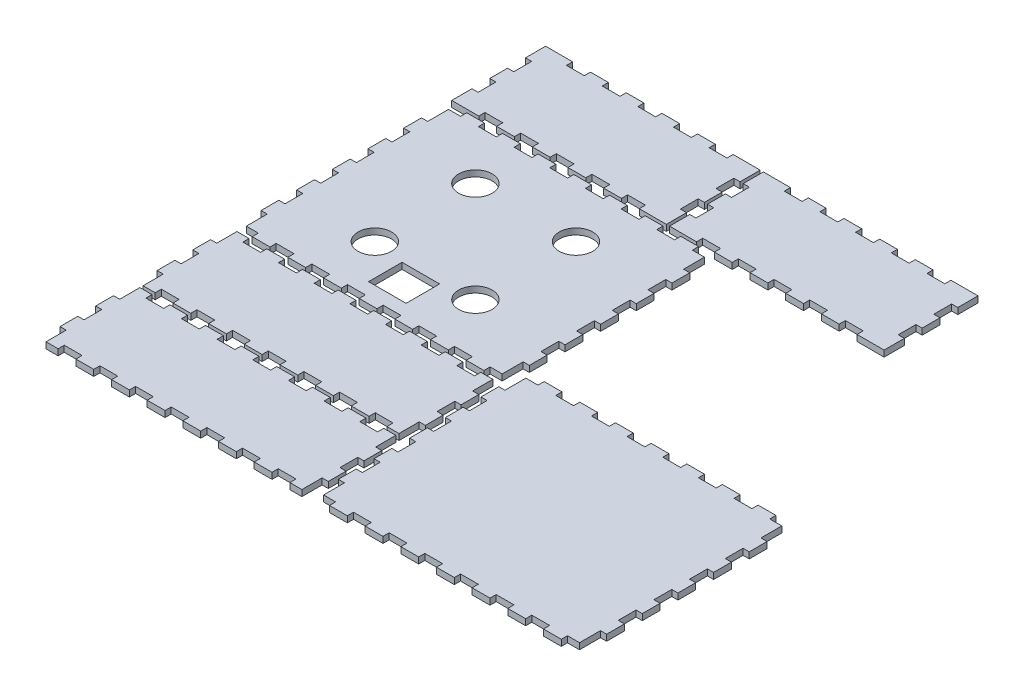
from build123d import *

# Parameters (mm, degrees)
BOSS_EXTRUDE2_DEPTH   = 5.842
BOSS_EXTRUDE2_2_DEPTH = 5.842
BOSS_EXTRUDE2_3_DEPTH = 5.842
BOSS_EXTRUDE2_4_DEPTH = 5.842
BOSS_EXTRUDE2_5_DEPTH = 5.842
BOSS_EXTRUDE2_6_DEPTH = 5.842
SKETCH7_R             = 15.875
SKETCH7_W             = 35.56
SKETCH7_H             = 31.75
CUT_EXTRUDE1_DEPTH    = 705.585827108


with BuildPart() as part:
    # Sketch6 → Boss-Extrude2 (new body)
    with BuildSketch(Plane(origin=(0, 0, 0), x_dir=(1, 0, 0), z_dir=(0, 1, 0))):
        Polygon((45.5168, 481.8888), (45.5168, 476.0468), (28.6258, 476.0468), (28.6258, 481.8888), (8.8392, 481.8888), (2.9972, 481.8888), (2.9972, 476.0468), (2.9972, 462.7626), (8.8392, 462.7626), (8.8392, 445.897), (2.9972, 445.897), (2.9972, 429.006), (8.8392, 429.006), (8.8392, 412.1404), (2.9972, 412.1404), (2.9972, 398.8308), (2.9972, 392.9888), (8.8392, 392.9888), (28.6258, 392.9888), (28.6258, 398.8308), (45.5168, 398.8308), (45.5168, 392.9888), (62.4078, 392.9888), (62.4078, 398.8308), (79.2734, 398.8308), (79.2734, 392.9888), (96.1644, 392.9888), (96.1644, 398.8308), (113.03, 398.8308), (113.03, 392.9888), (129.921, 392.9888), (129.921, 398.8308), (146.812, 398.8308), (146.812, 392.9888), (163.6776, 392.9888), (163.6776, 398.8308), (180.5686, 398.8308), (180.5686, 392.9888), (200.3552, 392.9888), (206.1972, 392.9888), (206.1972, 398.8308), (206.1972, 412.1404), (200.3552, 412.1404), (200.3552, 429.006), (206.1972, 429.006), (206.1972, 445.897), (200.3552, 445.897), (200.3552, 462.7626), (206.1972, 462.7626), (206.1972, 476.0468), (206.1972, 481.8888), (200.3552, 481.8888), (180.5686, 481.8888), (180.5686, 476.0468), (163.6776, 476.0468), (163.6776, 481.8888), (146.812, 481.8888), (146.812, 476.0468), (129.921, 476.0468), (129.921, 481.8888), (113.03, 481.8888), (113.03, 476.0468), (96.1644, 476.0468), (96.1644, 481.8888), (79.2734, 481.8888), (79.2734, 476.0468), (62.4078, 476.0468), (62.4078, 481.8888), align=None)
    extrude(amount=BOSS_EXTRUDE2_DEPTH)


with BuildPart() as body_2:
    # Sketch6 → Boss-Extrude2 2 (new body)
    with BuildSketch(Plane(origin=(0, 0, 0), x_dir=(1, 0, 0), z_dir=(0, 1, 0))):
        Polygon((251.714, 481.8888), (251.714, 476.0468), (234.823, 476.0468), (234.823, 481.8888), (215.0364, 481.8888), (209.1944, 481.8888), (209.1944, 476.0468), (209.1944, 462.7626), (215.0364, 462.7626), (215.0364, 445.897), (209.1944, 445.897), (209.1944, 429.006), (215.0364, 429.006), (215.0364, 412.1404), (209.1944, 412.1404), (209.1944, 398.8308), (209.1944, 392.9888), (215.0364, 392.9888), (234.823, 392.9888), (234.823, 398.8308), (251.714, 398.8308), (251.714, 392.9888), (268.605, 392.9888), (268.605, 398.8308), (285.4706, 398.8308), (285.4706, 392.9888), (302.3616, 392.9888), (302.3616, 398.8308), (319.2272, 398.8308), (319.2272, 392.9888), (336.1182, 392.9888), (336.1182, 398.8308), (353.0092, 398.8308), (353.0092, 392.9888), (369.8748, 392.9888), (369.8748, 398.8308), (386.7658, 398.8308), (386.7658, 392.9888), (406.5524, 392.9888), (412.3944, 392.9888), (412.3944, 398.8308), (412.3944, 412.1404), (406.5524, 412.1404), (406.5524, 429.006), (412.3944, 429.006), (412.3944, 445.897), (406.5524, 445.897), (406.5524, 462.7626), (412.3944, 462.7626), (412.3944, 476.0468), (412.3944, 481.8888), (406.5524, 481.8888), (386.7658, 481.8888), (386.7658, 476.0468), (369.8748, 476.0468), (369.8748, 481.8888), (353.0092, 481.8888), (353.0092, 476.0468), (336.1182, 476.0468), (336.1182, 481.8888), (319.2526, 481.8888), (319.2526, 476.0468), (302.3616, 476.0468), (302.3616, 481.8888), (285.4706, 481.8888), (285.4706, 476.0468), (268.605, 476.0468), (268.605, 481.8888), align=None)
    extrude(amount=BOSS_EXTRUDE2_2_DEPTH)


with BuildPart() as body_3:
    # Sketch6 → Boss-Extrude2 3 (new body)
    with BuildSketch(Plane(origin=(0, 0, 0), x_dir=(1, 0, 0), z_dir=(0, 1, 0))):
        Polygon((256.9972, 296.8498), (251.1552, 296.8498), (251.1552, 313.7154), (256.9972, 313.7154), (256.9972, 330.6064), (251.1552, 330.6064), (251.1552, 347.4974), (256.9972, 347.4974), (256.9972, 364.363), (251.1552, 364.363), (251.1552, 384.1496), (239.7252, 384.1496), (239.7252, 389.9916), (222.8596, 389.9916), (222.8596, 384.1496), (205.9686, 384.1496), (205.9686, 389.9916), (189.0776, 389.9916), (189.0776, 384.1496), (172.212, 384.1496), (172.212, 389.9916), (155.321, 389.9916), (155.321, 384.1496), (138.43, 384.1496), (138.43, 389.9916), (121.5644, 389.9916), (121.5644, 384.1496), (104.6734, 384.1496), (104.6734, 389.9916), (87.8078, 389.9916), (87.8078, 384.1496), (70.9168, 384.1496), (70.9168, 389.9916), (54.0258, 389.9916), (54.0258, 384.1496), (37.1602, 384.1496), (37.1602, 389.9916), (20.2692, 389.9916), (20.2692, 384.1496), (8.8392, 384.1496), (8.8392, 364.363), (2.9972, 364.363), (2.9972, 347.4974), (8.8392, 347.4974), (8.8392, 330.6064), (2.9972, 330.6064), (2.9972, 313.7154), (8.8392, 313.7154), (8.8392, 296.8498), (2.9972, 296.8498), (2.9972, 279.9588), (8.8392, 279.9588), (8.8392, 263.0678), (2.9972, 263.0678), (2.9972, 246.2022), (8.8392, 246.2022), (8.8392, 229.3112), (2.9972, 229.3112), (2.9972, 212.4456), (8.8392, 212.4456), (8.8392, 192.6336), (20.2692, 192.6336), (20.2692, 186.7916), (37.1602, 186.7916), (37.1602, 192.6336), (54.0258, 192.6336), (54.0258, 186.7916), (70.9168, 186.7916), (70.9168, 192.6336), (87.8078, 192.6336), (87.8078, 186.7916), (104.6734, 186.7916), (104.6734, 192.6336), (121.5644, 192.6336), (121.5644, 186.7916), (138.43, 186.7916), (138.43, 192.6336), (155.321, 192.6336), (155.321, 186.7916), (172.212, 186.7916), (172.212, 192.6336), (189.0776, 192.6336), (189.0776, 186.7916), (205.9686, 186.7916), (205.9686, 192.6336), (222.8596, 192.6336), (222.8596, 186.7916), (239.7252, 186.7916), (239.7252, 192.6336), (251.1552, 192.6336), (251.1552, 212.4456), (256.9972, 212.4456), (256.9972, 229.3112), (251.1552, 229.3112), (251.1552, 246.2022), (256.9972, 246.2022), (256.9972, 263.0678), (251.1552, 263.0678), (251.1552, 279.9588), (256.9972, 279.9588), align=None)
    extrude(amount=BOSS_EXTRUDE2_3_DEPTH)

    # Sketch7 → Cut-Extrude1 (cut, through all)
    with BuildSketch(Plane(origin=(0, 5.842, 0), x_dir=(1, 0, 0), z_dir=(0, 1, 0))):
        with Locations(Location((82.3722, 336.0293, 0), (0, 0, 270))):
            Circle(SKETCH7_R)
        with Locations(Location((177.6222, 336.0293, 0), (0, 0, 270))):
            Circle(SKETCH7_R)
        with Locations(Location((177.6222, 240.7793, 0), (0, 0, 270))):
            Circle(SKETCH7_R)
        with Locations(Location((82.3722, 240.7793, 0), (0, 0, 270))):
            Circle(SKETCH7_R)
        with Locations((129.9972, 220.8784)):
            Rectangle(SKETCH7_W, SKETCH7_H)
    extrude(amount=-CUT_EXTRUDE1_DEPTH, mode=Mode.SUBTRACT)


with BuildPart() as body_4:
    # Sketch6 → Boss-Extrude2 4 (new body)
    with BuildSketch(Plane(origin=(0, 0, 0), x_dir=(1, 0, 0), z_dir=(0, 1, 0))):
        Polygon((311.023, 206.1972), (311.023, 200.3552), (294.1574, 200.3552), (294.1574, 206.1972), (277.2664, 206.1972), (277.2664, 200.3552), (265.8364, 200.3552), (265.8364, 180.5686), (259.9944, 180.5686), (259.9944, 163.6776), (265.8364, 163.6776), (265.8364, 146.812), (259.9944, 146.812), (259.9944, 129.921), (265.8364, 129.921), (265.8364, 113.03), (259.9944, 113.03), (259.9944, 96.1644), (265.8364, 96.1644), (265.8364, 79.2734), (259.9944, 79.2734), (259.9944, 62.4078), (265.8364, 62.4078), (265.8364, 45.5168), (259.9944, 45.5168), (259.9944, 28.6258), (265.8364, 28.6258), (265.8364, 8.8392), (277.2664, 8.8392), (277.2664, 2.9972), (294.1574, 2.9972), (294.1574, 8.8392), (311.023, 8.8392), (311.023, 2.9972), (327.914, 2.9972), (327.914, 8.8392), (344.805, 8.8392), (344.805, 2.9972), (361.6706, 2.9972), (361.6706, 8.8392), (378.5616, 8.8392), (378.5616, 2.9972), (395.4526, 2.9972), (395.4526, 8.8392), (412.3182, 8.8392), (412.3182, 2.9972), (429.2092, 2.9972), (429.2092, 8.8392), (446.0748, 8.8392), (446.0748, 2.9972), (462.9658, 2.9972), (462.9658, 8.8392), (479.8568, 8.8392), (479.8568, 2.9972), (496.7224, 2.9972), (496.7224, 8.8392), (508.1524, 8.8392), (508.1524, 28.6258), (513.9944, 28.6258), (513.9944, 45.5168), (508.1524, 45.5168), (508.1524, 62.4078), (513.9944, 62.4078), (513.9944, 79.2734), (508.1524, 79.2734), (508.1524, 96.1644), (513.9944, 96.1644), (513.9944, 113.03), (508.1524, 113.03), (508.1524, 129.921), (513.9944, 129.921), (513.9944, 146.812), (508.1524, 146.812), (508.1524, 163.6776), (513.9944, 163.6776), (513.9944, 180.5686), (508.1524, 180.5686), (508.1524, 200.3552), (496.7224, 200.3552), (496.7224, 206.1972), (479.8568, 206.1972), (479.8568, 200.3552), (462.9658, 200.3552), (462.9658, 206.1972), (446.0748, 206.1972), (446.0748, 200.3552), (429.2092, 200.3552), (429.2092, 206.1972), (412.3182, 206.1972), (412.3182, 200.3552), (395.4526, 200.3552), (395.4526, 206.1972), (378.5616, 206.1972), (378.5616, 200.3552), (361.6706, 200.3552), (361.6706, 206.1972), (344.805, 206.1972), (344.805, 200.3552), (327.914, 200.3552), (327.914, 206.1972), align=None)
    extrude(amount=BOSS_EXTRUDE2_4_DEPTH)


with BuildPart() as body_5:
    # Sketch6 → Boss-Extrude2 5 (new body)
    with BuildSketch(Plane(origin=(0, 0, 0), x_dir=(1, 0, 0), z_dir=(0, 1, 0))):
        Polygon((2.9972, 147.8026), (8.8392, 147.8026), (8.8392, 130.9116), (2.9972, 130.9116), (2.9972, 114.0206), (8.8392, 114.0206), (8.8392, 100.7364), (8.8392, 94.8944), (20.2692, 94.8944), (20.2692, 100.7364), (37.1602, 100.7364), (37.1602, 94.8944), (54.0258, 94.8944), (54.0258, 100.7364), (70.9168, 100.7364), (70.9168, 94.8944), (87.8078, 94.8944), (87.8078, 100.7364), (104.6734, 100.7364), (104.6734, 94.8944), (121.5644, 94.8944), (121.5644, 100.7364), (138.43, 100.7364), (138.43, 94.8944), (155.321, 94.8944), (155.321, 100.7364), (172.212, 100.7364), (172.212, 94.8944), (189.0776, 94.8944), (189.0776, 100.7364), (205.9686, 100.7364), (205.9686, 94.8944), (222.8596, 94.8944), (222.8596, 100.7364), (239.7252, 100.7364), (239.7252, 94.8944), (251.1552, 94.8944), (251.1552, 100.7364), (251.1552, 114.0206), (256.9972, 114.0206), (256.9972, 130.9116), (251.1552, 130.9116), (251.1552, 147.8026), (256.9972, 147.8026), (256.9972, 164.6682), (251.1552, 164.6682), (251.1552, 177.9524), (251.1552, 183.7944), (239.7252, 183.7944), (239.7252, 177.9524), (222.8596, 177.9524), (222.8596, 183.7944), (205.9686, 183.7944), (205.9686, 177.9524), (189.0776, 177.9524), (189.0776, 183.7944), (172.212, 183.7944), (172.212, 177.9524), (155.321, 177.9524), (155.321, 183.7944), (138.43, 183.7944), (138.43, 177.9524), (121.5644, 177.9524), (121.5644, 183.7944), (104.6734, 183.7944), (104.6734, 177.9524), (87.8078, 177.9524), (87.8078, 183.7944), (70.9168, 183.7944), (70.9168, 177.9524), (54.0258, 177.9524), (54.0258, 183.7944), (37.1602, 183.7944), (37.1602, 177.9524), (20.2692, 177.9524), (20.2692, 183.7944), (8.8392, 183.7944), (8.8392, 177.9524), (8.8392, 164.6682), (2.9972, 164.6682), align=None)
    extrude(amount=BOSS_EXTRUDE2_5_DEPTH)


with BuildPart() as body_6:
    # Sketch6 → Boss-Extrude2 6 (new body)
    with BuildSketch(Plane(origin=(0, 0, 0), x_dir=(1, 0, 0), z_dir=(0, 1, 0))):
        Polygon((54.0258, 2.9972), (54.0258, 8.8392), (70.9168, 8.8392), (70.9168, 2.9972), (87.8078, 2.9972), (87.8078, 8.8392), (104.6734, 8.8392), (104.6734, 2.9972), (121.5644, 2.9972), (121.5644, 8.8392), (138.43, 8.8392), (138.43, 2.9972), (155.321, 2.9972), (155.321, 8.8392), (172.212, 8.8392), (172.212, 2.9972), (189.0776, 2.9972), (189.0776, 8.8392), (205.9686, 8.8392), (205.9686, 2.9972), (222.8596, 2.9972), (222.8596, 8.8392), (239.7252, 8.8392), (239.7252, 2.9972), (251.1552, 2.9972), (251.1552, 8.8392), (251.1552, 22.1234), (256.9972, 22.1234), (256.9972, 39.0144), (251.1552, 39.0144), (251.1552, 55.88), (256.9972, 55.88), (256.9972, 72.771), (251.1552, 72.771), (251.1552, 86.0552), (251.1552, 91.8972), (239.7252, 91.8972), (239.7252, 86.0552), (222.8596, 86.0552), (222.8596, 91.8972), (205.9686, 91.8972), (205.9686, 86.0552), (189.0776, 86.0552), (189.0776, 91.8972), (172.212, 91.8972), (172.212, 86.0552), (155.321, 86.0552), (155.321, 91.8972), (138.43, 91.8972), (138.43, 86.0552), (121.5644, 86.0552), (121.5644, 91.8972), (104.6734, 91.8972), (104.6734, 86.0552), (87.8078, 86.0552), (87.8078, 91.8972), (70.9168, 91.8972), (70.9168, 86.0552), (54.0258, 86.0552), (54.0258, 91.8972), (37.1602, 91.8972), (37.1602, 86.0552), (20.2692, 86.0552), (20.2692, 91.8972), (8.8392, 91.8972), (8.8392, 86.0552), (8.8392, 72.771), (2.9972, 72.771), (2.9972, 55.88), (8.8392, 55.88), (8.8392, 39.0144), (2.9972, 39.0144), (2.9972, 22.1234), (8.8392, 22.1234), (8.8392, 8.8392), (8.8392, 2.9972), (20.2692, 2.9972), (20.2692, 8.8392), (37.1602, 8.8392), (37.1602, 2.9972), align=None)
    extrude(amount=BOSS_EXTRUDE2_6_DEPTH)


solid = Compound([part.part, body_2.part, body_3.part, body_4.part, body_5.part, body_6.part])
